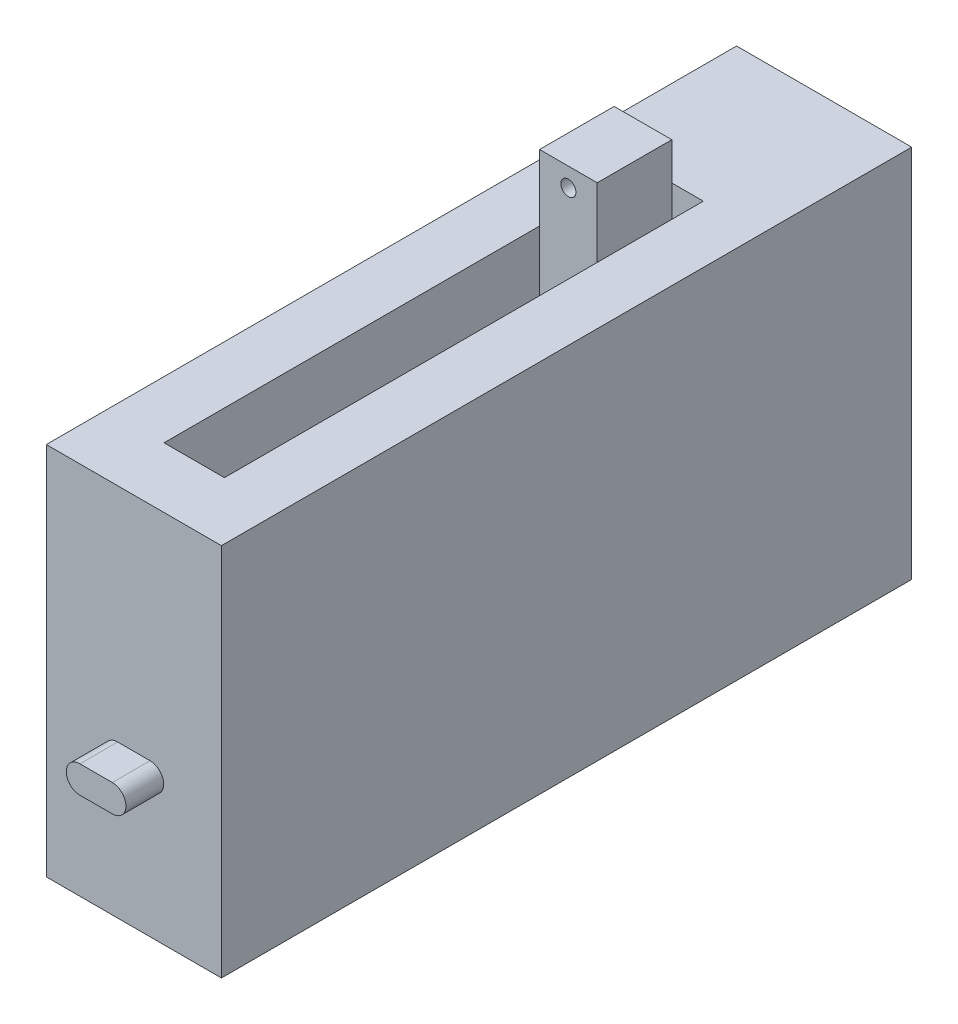
from build123d import *

# Parameters (mm, degrees)
SKETCH1_W           = 7.366
SKETCH1_H           = 29.0322
BOSS_EXTRUDE1_DEPTH = 15.748
SKETCH2_W           = 2.54
SKETCH2_H           = 20.1422
CUT_EXTRUDE1_DEPTH  = 3.175
SKETCH3_W           = 2.4257
SKETCH3_H           = 3.1369
BOSS_EXTRUDE2_DEPTH = 6.0198
SKETCH4_R           = 0.3175
CUT_EXTRUDE2_DEPTH  = 29.596136272
BOSS_EXTRUDE3_DEPTH = 1.5875


with BuildPart() as part:
    # Sketch1 → Boss-Extrude1 (new body)
    with BuildSketch(Plane(origin=(0, 0, 0), x_dir=(1, 0, 0), z_dir=(0, 1, 0))):
        Rectangle(SKETCH1_W, SKETCH1_H)
    extrude(amount=BOSS_EXTRUDE1_DEPTH)

    # Sketch2 → Cut-Extrude1 (cut)
    with BuildSketch(Plane(origin=(0, 15.748, 0), x_dir=(1, 0, 0), z_dir=(0, 1, 0))):
        with Locations((0, -1.905)):
            Rectangle(SKETCH2_W, SKETCH2_H)
    extrude(amount=-CUT_EXTRUDE1_DEPTH, mode=Mode.SUBTRACT)

    # Sketch3 → Boss-Extrude2 (add)
    with BuildSketch(Plane(origin=(0, 12.573, 0), x_dir=(1, 0, 0), z_dir=(0, 1, 0))):
        with Locations((0, 5.32765)):
            Rectangle(SKETCH3_W, SKETCH3_H)
    extrude(amount=BOSS_EXTRUDE2_DEPTH)

    # Sketch4 → Cut-Extrude2 (cut, through all)
    with BuildSketch(Plane(origin=(0, 0, -6.8961), x_dir=(-1, 0, 0), z_dir=(0, 0, -1))):
        with Locations((0, 17.79905)):
            Circle(SKETCH4_R)
    extrude(amount=-CUT_EXTRUDE2_DEPTH, mode=Mode.SUBTRACT)

    # Sketch5 → Boss-Extrude3 (add)
    with BuildSketch(Plane.XY.offset(14.5161)):
        with BuildLine():
            Line((-0.682666257, 6.414003725), (0.682666257, 6.414003725))
            ThreePointArc((0.682666257, 6.414003725), (1.254669982, 5.842), (0.682666257, 5.269996275))
            Line((0.682666257, 5.269996275), (-0.682666257, 5.269996275))
            ThreePointArc((-0.682666257, 5.269996275), (-1.254669982, 5.842), (-0.682666257, 6.414003725))
        make_face()
    extrude(amount=BOSS_EXTRUDE3_DEPTH)


solid = part.part
